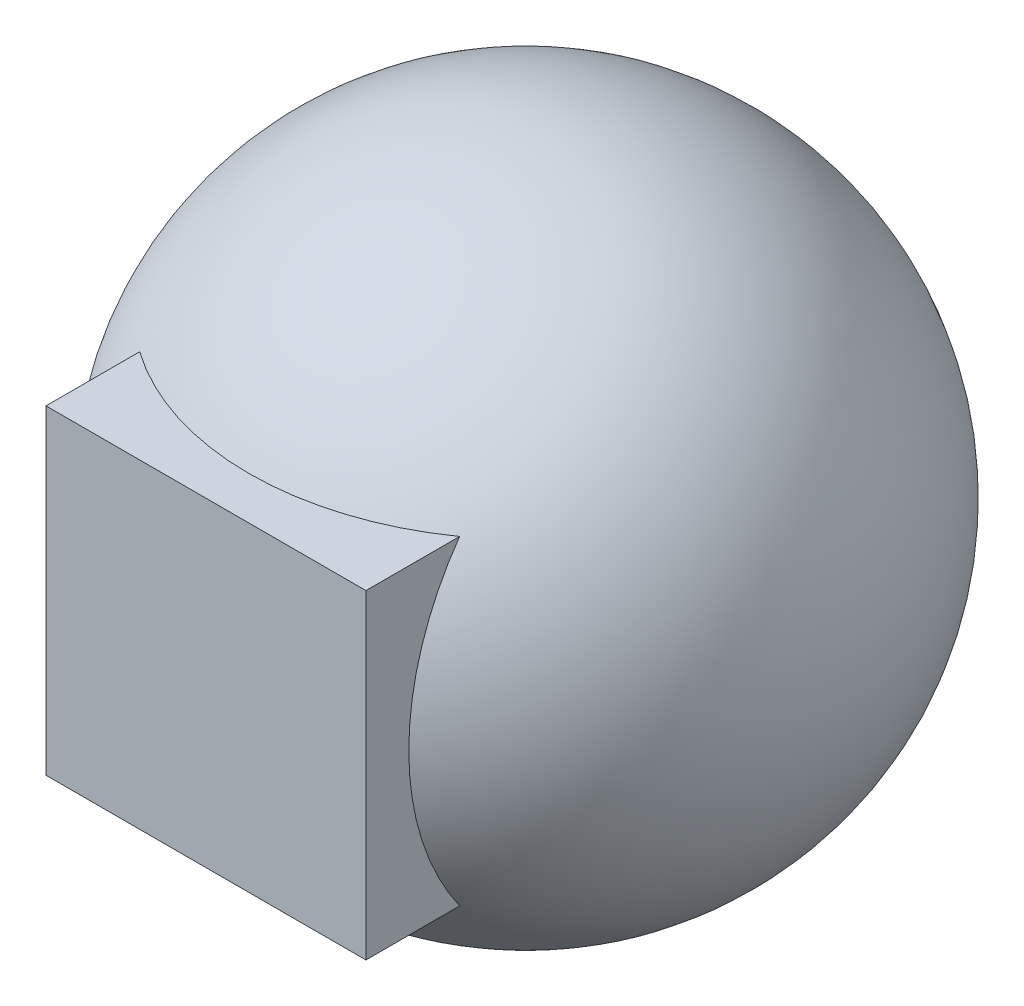
from build123d import *

# Parameters (mm, degrees)
CROQUIS6_W              = 20
CROQUIS6_H              = 20
SALIENTE_EXTRUIR2_DEPTH = 20


with BuildPart() as part:
    # Croquis1 → Revolución1 (revolve)
    with BuildSketch(Plane.XY):
        with BuildLine():
            Line((0, -20), (0, 20))
            ThreePointArc((0, 20), (20, 0), (0, -20))
        make_face()
    revolve(axis=Axis((0, -20, 0), (0, 1, 0)))

    # Croquis6 → Saliente-Extruir2 (add)
    with BuildSketch(Plane.XY):
        Rectangle(CROQUIS6_W, CROQUIS6_H)
    extrude(amount=SALIENTE_EXTRUIR2_DEPTH)


solid = part.part
